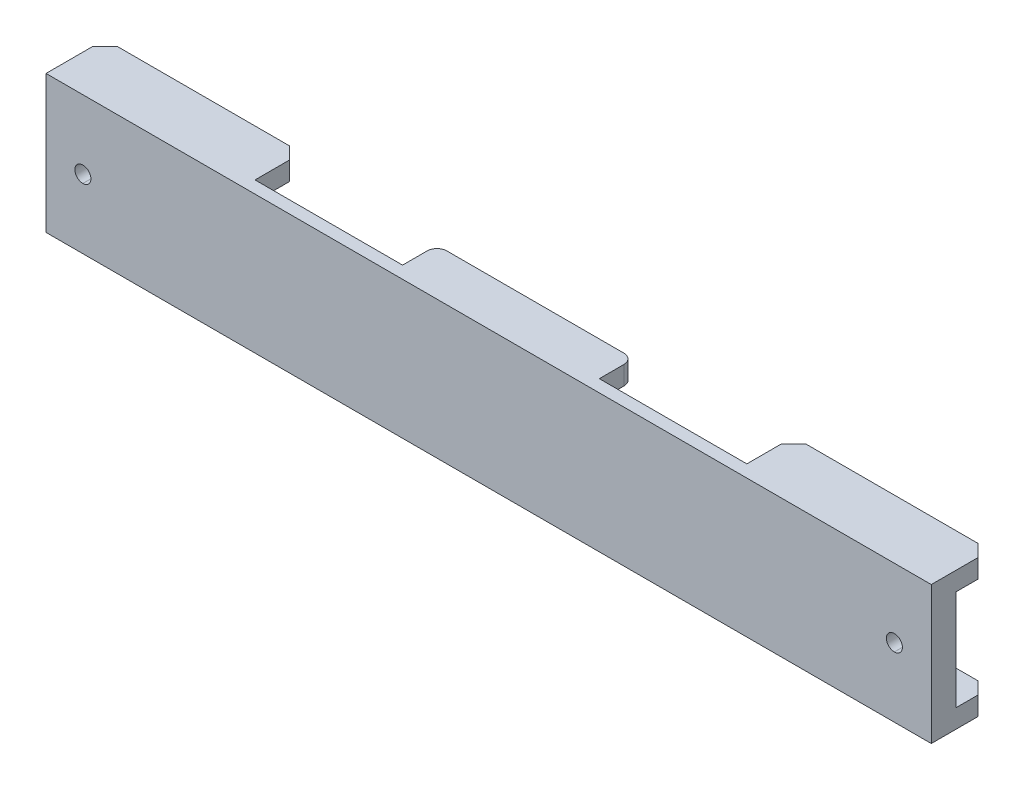
from build123d import *

# Parameters (mm, degrees)
SKETCH1_W           = 180
SKETCH1_H           = 28
BOSS_EXTRUDE1_DEPTH = 5
SKETCH2_W           = 40
SKETCH2_H           = 7
SKETCH2_H_2         = 4.5
BOSS_EXTRUDE2_DEPTH = 3.8
CHAMFER1_SIZE       = 2.5
FILLET1_R           = 2
SKETCH3_W           = 2
SKETCH3_H           = 5
BOSS_EXTRUDE3_DEPTH = 2
CUT_EXTRUDE1_DEPTH  = 167.883192683
SKETCH5_W           = 30
SKETCH5_H           = 2.5
CUT_EXTRUDE2_DEPTH  = 3.8
CUT_EXTRUDE3_START  = -28
SKETCH5_2_W         = 30
SKETCH5_2_H         = 2.5
CUT_EXTRUDE3_DEPTH  = 3.8
SKETCH7_W           = 8
SKETCH7_H           = 18.4
SKETCH7_R           = 1.7
BOSS_EXTRUDE4_DEPTH = 3.5
FILLET2_R           = 2


with BuildPart() as part:
    # Sketch1 → Boss-Extrude1 (new body)
    with BuildSketch(Plane.XY):
        with Locations((-75, 10)):
            Rectangle(SKETCH1_W, SKETCH1_H)
    extrude(amount=BOSS_EXTRUDE1_DEPTH)

    # Sketch2 → Boss-Extrude2 (add)
    with BuildSketch(Plane(origin=(0, -4, 0), x_dir=(-1, 0, 0), z_dir=(0, -1, 0))):
        with Locations((5, 3.5)):
            Rectangle(SKETCH2_W, SKETCH2_H)
        with Locations((75, 2.25)):
            Rectangle(SKETCH2_W, SKETCH2_H_2)
        with Locations((145, 3.5)):
            Rectangle(SKETCH2_W, SKETCH2_H)
    extrude(amount=-BOSS_EXTRUDE2_DEPTH)

    # Chamfer1
    chamfer1_edges = [part.edges().sort_by_distance(p)[0] for p in [
        (-25, -2.1, -7),
        (15, -2.1, -7),
        (-125, -2.1, -7),
        (-165, -2.1, -7),
    ]]
    chamfer(chamfer1_edges, length=CHAMFER1_SIZE)

    # Fillet1
    fillet1_edges = [part.edges().sort_by_distance(p)[0] for p in [
        (-95, -2.1, -4.5),
        (-55, -2.1, -4.5),
    ]]
    fillet(fillet1_edges, radius=FILLET1_R)

    # Mirror1: part across plane


with BuildPart() as part_1:
    add(part.part)
    add(part.part.mirror(Plane.ZX.offset(10)))

    # Sketch3 → Boss-Extrude3 (add)
    with BuildSketch(Plane(origin=(0, 0, 0), x_dir=(-1, 0, 0), z_dir=(0, 0, -1))):
        with Locations((-1.5, 17.7)):
            Rectangle(SKETCH3_W, SKETCH3_H)
        with Locations((-1.5, 2.3)):
            Rectangle(SKETCH3_W, SKETCH3_H)
        with Locations((151.5, 17.7)):
            Rectangle(SKETCH3_W, SKETCH3_H)
        with Locations((151.5, 2.3)):
            Rectangle(SKETCH3_W, SKETCH3_H)
    extrude(amount=BOSS_EXTRUDE3_DEPTH)

    # Sketch4 → Cut-Extrude1 (cut, through all)
    with BuildSketch(Plane(origin=(0, 0, 0), x_dir=(-1, 0, 0), z_dir=(0, 0, -1))):
        with BuildLine():
            Line((-7.51, 11.62), (-7.49, 11.62))
            ThreePointArc((-7.49, 11.62), (-5.87, 10), (-7.49, 8.38))
            Line((-7.49, 8.38), (-7.51, 8.38))
            ThreePointArc((-7.51, 8.38), (-9.13, 10), (-7.51, 11.62))
        make_face()
        with BuildLine():
            Line((157.51, 11.62), (157.49, 11.62))
            ThreePointArc((157.49, 11.62), (155.87, 10), (157.49, 8.38))
            Line((157.49, 8.38), (157.51, 8.38))
            ThreePointArc((157.51, 8.38), (159.13, 10), (157.51, 11.62))
        make_face()
    extrude(amount=-CUT_EXTRUDE1_DEPTH, mode=Mode.SUBTRACT)

    # Sketch5 → Cut-Extrude2 (cut)
    with BuildSketch(Plane.XZ.offset(4)):
        with Locations((-40, 1.25)):
            Rectangle(SKETCH5_W, SKETCH5_H)
        with Locations((-110, 1.25)):
            Rectangle(SKETCH5_W, SKETCH5_H)
    extrude(amount=-CUT_EXTRUDE2_DEPTH, mode=Mode.SUBTRACT)

    # Sketch5<2> → Cut-Extrude3 (cut)
    with BuildSketch(Plane.XZ.offset(4).offset(CUT_EXTRUDE3_START)):
        with Locations((-40, 1.25)):
            Rectangle(SKETCH5_2_W, SKETCH5_2_H)
        with Locations((-110, 1.25)):
            Rectangle(SKETCH5_2_W, SKETCH5_2_H)
    extrude(amount=CUT_EXTRUDE3_DEPTH, mode=Mode.SUBTRACT)


with BuildPart() as body_2:
    # Sketch7 → Boss-Extrude4 (new body)
    with BuildSketch(Plane(origin=(0, 0, 0), x_dir=(-1, 0, 0), z_dir=(0, 0, -1))):
        with Locations((-7.5, 10)):
            Rectangle(SKETCH7_W, SKETCH7_H)
        with Locations((-7.5, 10)):
            Circle(SKETCH7_R, mode=Mode.SUBTRACT)
    extrude(amount=BOSS_EXTRUDE4_DEPTH)

    # Fillet2
    fillet2_edges = [body_2.edges().sort_by_distance(p)[0] for p in [
        (3.5, 0.8, -1.75),
        (11.5, 0.8, -1.75),
        (11.5, 19.2, -1.75),
        (3.5, 19.2, -1.75),
    ]]
    fillet(fillet2_edges, radius=FILLET2_R)


solid = Compound([part_1.part, body_2.part])
